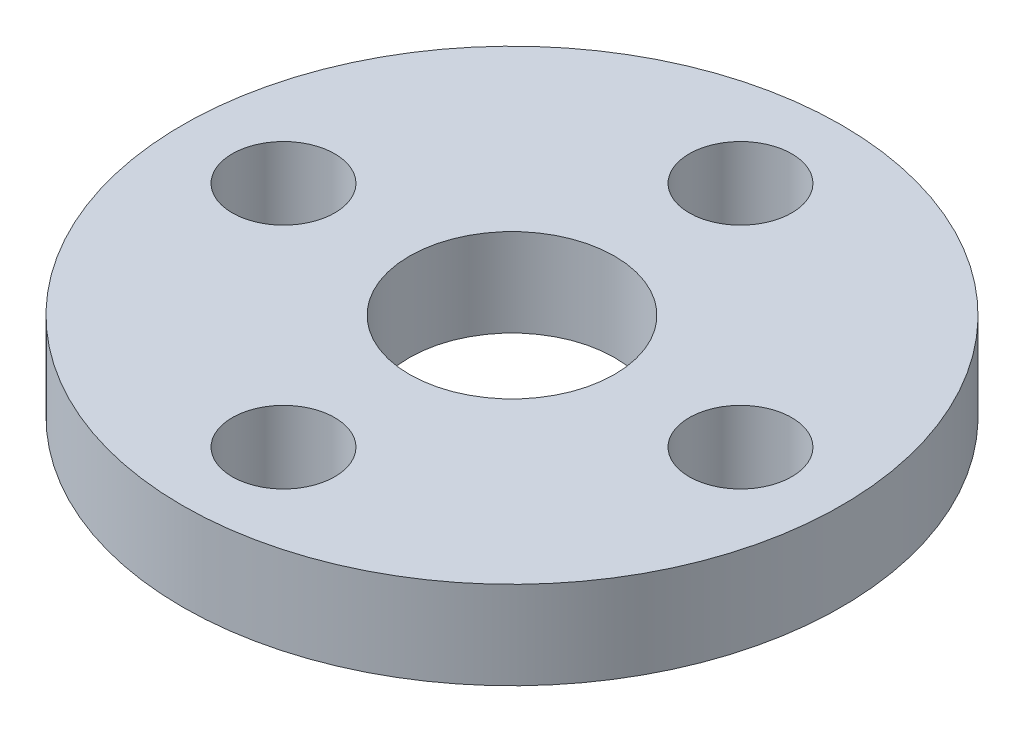
from build123d import *

# Parameters (mm, degrees)
SKETCH1_R           = 11.25
BOSS_EXTRUDE1_DEPTH = 3
CUT_EXTRUDE1_REACH  = 18.19
SKETCH2_R           = 1.75
SKETCH2_R_2         = 3.5


with BuildPart() as part:
    # Sketch1 → Boss-Extrude1 (new body)
    with BuildSketch(Plane(origin=(0, 0, 0), x_dir=(1, 0, 0), z_dir=(0, 1, 0))):
        with Locations(Location((0, 0, 0), (0, 0, 270))):
            Circle(SKETCH1_R)
    extrude(amount=BOSS_EXTRUDE1_DEPTH)

    # Sketch2 → Cut-Extrude1 (cut, up to next)
    with BuildSketch(Plane(origin=(0, 3, 0), x_dir=(1, 0, 0), z_dir=(0, 1, 0)), mode=Mode.PRIVATE) as cut_extrude1_sk1:
        with Locations(Location((0, 7.8, 0), (0, 0, 270))):
            Circle(SKETCH2_R)
    cut_extrude1_tool1 = extrude(cut_extrude1_sk1.sketch, amount=-CUT_EXTRUDE1_REACH, mode=Mode.PRIVATE) & part.part
    # Sketch2 → Cut-Extrude1 (cut, up to next)
    with BuildSketch(Plane(origin=(0, 3, 0), x_dir=(1, 0, 0), z_dir=(0, 1, 0)), mode=Mode.PRIVATE) as cut_extrude1_sk2:
        with Locations(Location((7.8, 0, 0), (0, 0, 270))):
            Circle(SKETCH2_R)
    cut_extrude1_tool2 = extrude(cut_extrude1_sk2.sketch, amount=-CUT_EXTRUDE1_REACH, mode=Mode.PRIVATE) & part.part
    # Sketch2 → Cut-Extrude1 (cut, up to next)
    with BuildSketch(Plane(origin=(0, 3, 0), x_dir=(1, 0, 0), z_dir=(0, 1, 0)), mode=Mode.PRIVATE) as cut_extrude1_sk3:
        with Locations(Location((0, -7.8, 0), (0, 0, 270))):
            Circle(SKETCH2_R)
    cut_extrude1_tool3 = extrude(cut_extrude1_sk3.sketch, amount=-CUT_EXTRUDE1_REACH, mode=Mode.PRIVATE) & part.part
    # Sketch2 → Cut-Extrude1 (cut, up to next)
    with BuildSketch(Plane(origin=(0, 3, 0), x_dir=(1, 0, 0), z_dir=(0, 1, 0)), mode=Mode.PRIVATE) as cut_extrude1_sk4:
        with Locations(Location((-7.8, 0, 0), (0, 0, 270))):
            Circle(SKETCH2_R)
    cut_extrude1_tool4 = extrude(cut_extrude1_sk4.sketch, amount=-CUT_EXTRUDE1_REACH, mode=Mode.PRIVATE) & part.part
    # Sketch2 → Cut-Extrude1 (cut, up to next)
    with BuildSketch(Plane(origin=(0, 3, 0), x_dir=(1, 0, 0), z_dir=(0, 1, 0)), mode=Mode.PRIVATE) as cut_extrude1_sk5:
        with Locations(Location((0, 0, 0), (0, 0, 270))):
            Circle(SKETCH2_R_2)
    cut_extrude1_tool5 = extrude(cut_extrude1_sk5.sketch, amount=-CUT_EXTRUDE1_REACH, mode=Mode.PRIVATE) & part.part
    add(cut_extrude1_tool1.solids().sort_by_distance((0, 3, -7.8))[0], mode=Mode.SUBTRACT)
    add(cut_extrude1_tool2.solids().sort_by_distance((7.8, 3, 0))[0], mode=Mode.SUBTRACT)
    add(cut_extrude1_tool3.solids().sort_by_distance((0, 3, 7.8))[0], mode=Mode.SUBTRACT)
    add(cut_extrude1_tool4.solids().sort_by_distance((-7.8, 3, 0))[0], mode=Mode.SUBTRACT)
    add(cut_extrude1_tool5.solids().sort_by_distance((0, 3, 0))[0], mode=Mode.SUBTRACT)


solid = part.part
